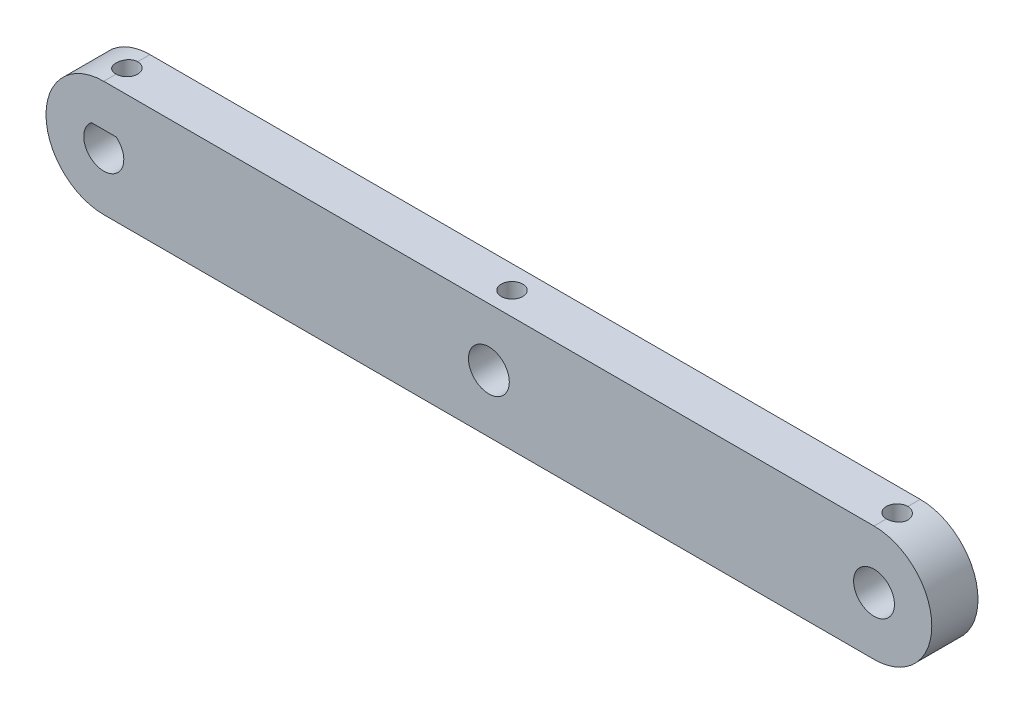
from build123d import *

# Parameters (mm, degrees)
SKETCH1_R           = 2.65
BOSS_EXTRUDE1_DEPTH = 6
CUT_EXTRUDE1_REACH  = 110.707
SKETCH2_R           = 1.4


with BuildPart() as part:
    # Sketch1 → Boss-Extrude1 (new body)
    with BuildSketch(Plane.XY):
        with BuildLine():
            Line((0, 7.5), (100, 7.5))
            ThreePointArc((100, 7.5), (107.5, 0), (100, -7.5))
            Line((100, -7.5), (0, -7.5))
            ThreePointArc((0, -7.5), (-7.5, 0), (0, 7.5))
        make_face()
        with Locations((50, 0)):
            Circle(SKETCH1_R, mode=Mode.SUBTRACT)
        with Locations((100, 0)):
            Circle(SKETCH1_R, mode=Mode.SUBTRACT)
        with BuildLine():
            Line((-1.599218559, 2.05), (1.599218559, 2.05))
            ThreePointArc((1.599218559, 2.05), (0, -2.6), (-1.599218559, 2.05))
        make_face(mode=Mode.SUBTRACT)
    extrude(amount=BOSS_EXTRUDE1_DEPTH)

    # Sketch2 → Cut-Extrude1 (cut, up to next)
    with BuildSketch(Plane(origin=(0, 7.5, 0), x_dir=(1, 0, 0), z_dir=(0, 1, 0)), mode=Mode.PRIVATE) as cut_extrude1_sk1:
        with Locations(Location((0, -3, 0), (0, 0, 90))):
            Circle(SKETCH2_R)
    cut_extrude1_tool1 = extrude(cut_extrude1_sk1.sketch, amount=-CUT_EXTRUDE1_REACH, mode=Mode.PRIVATE) & part.part
    # Sketch2 → Cut-Extrude1 (cut, up to next)
    with BuildSketch(Plane(origin=(0, 7.5, 0), x_dir=(1, 0, 0), z_dir=(0, 1, 0)), mode=Mode.PRIVATE) as cut_extrude1_sk2:
        with Locations(Location((50, -3, 0), (0, 0, 270))):
            Circle(SKETCH2_R)
    cut_extrude1_tool2 = extrude(cut_extrude1_sk2.sketch, amount=-CUT_EXTRUDE1_REACH, mode=Mode.PRIVATE) & part.part
    # Sketch2 → Cut-Extrude1 (cut, up to next)
    with BuildSketch(Plane(origin=(0, 7.5, 0), x_dir=(1, 0, 0), z_dir=(0, 1, 0)), mode=Mode.PRIVATE) as cut_extrude1_sk3:
        with Locations(Location((100, -3, 0), (0, 0, 270))):
            Circle(SKETCH2_R)
    cut_extrude1_tool3 = extrude(cut_extrude1_sk3.sketch, amount=-CUT_EXTRUDE1_REACH, mode=Mode.PRIVATE) & part.part
    add(cut_extrude1_tool1.solids().sort_by_distance((0, 7.5, 3))[0], mode=Mode.SUBTRACT)
    add(cut_extrude1_tool2.solids().sort_by_distance((50, 7.5, 3))[0], mode=Mode.SUBTRACT)
    add(cut_extrude1_tool3.solids().sort_by_distance((100, 7.5, 3))[0], mode=Mode.SUBTRACT)


solid = part.part
